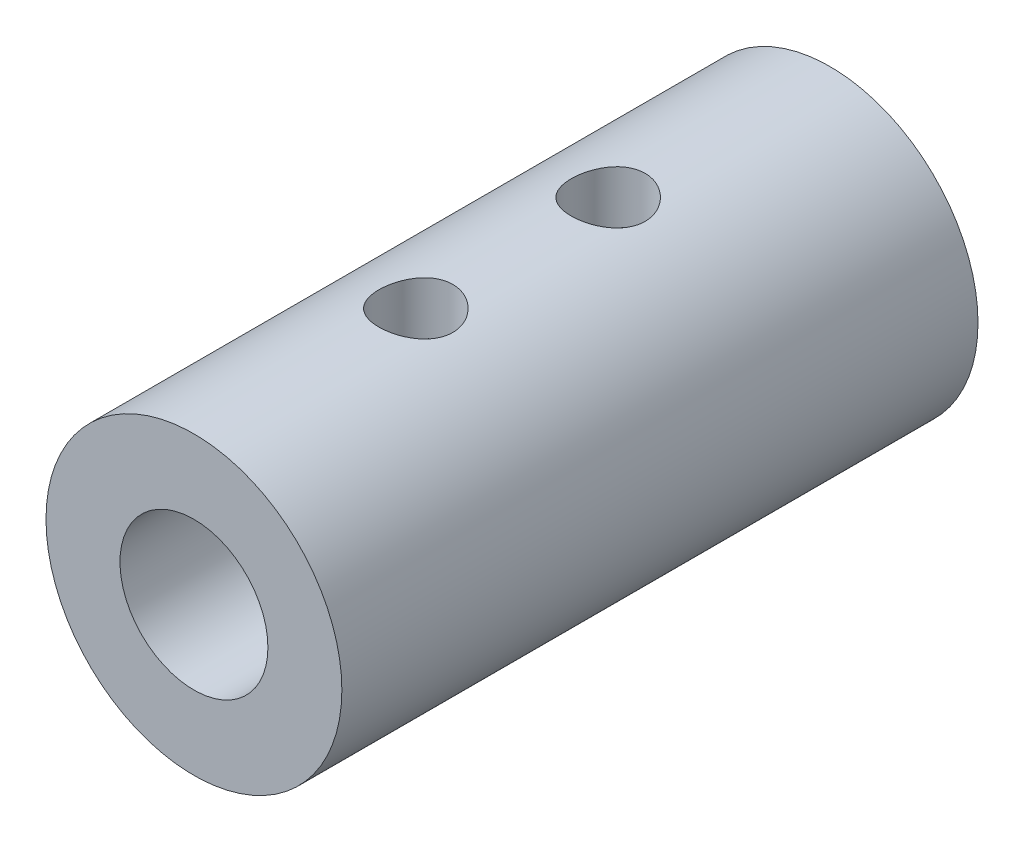
from build123d import *

# Parameters (mm, degrees)
CROQUIS1_R                 = 10
CROQUIS1_R_2               = 5
SALIENTE_EXTRUIR1_DEPTH    = 13
SALIENTE_EXTRUIR2_START    = -30
CROQUIS2_R                 = 10
CROQUIS2_R_2               = 6.48
SALIENTE_EXTRUIR2_DEPTH    = 30
CORTAR_EXTRUIR1_DEPTH      = 39.57274278
CORTAR_EXTRUIR1_DEPTH_BACK = 39.57274278
CROQUIS3_R                 = 2.5


with BuildPart() as part:
    # Croquis1 → Saliente-Extruir1 (new body)
    with BuildSketch(Plane.XY):
        with Locations(Location((-9.736276302, -4.083177315, 0), (0, 0, 180))):
            Circle(CROQUIS1_R)
        with Locations(Location((-9.736276302, -4.083177315, 0), (0, 0, 180))):
            Circle(CROQUIS1_R_2, mode=Mode.SUBTRACT)
    extrude(amount=SALIENTE_EXTRUIR1_DEPTH)

    # Croquis2 → Saliente-Extruir2 (add)
    with BuildSketch(Plane.XY.offset(SALIENTE_EXTRUIR2_START)):
        with Locations(Location((-9.736276302, -4.083177315, 0), (0, 0, 180))):
            Circle(CROQUIS2_R)
        with Locations((-9.736276302, -4.083177315)):
            Circle(CROQUIS2_R_2, mode=Mode.SUBTRACT)
    extrude(amount=SALIENTE_EXTRUIR2_DEPTH)

    # Croquis3 → Cortar-Extruir1 (cut, two sides: drawn at the far end of the back side and taken through both)
    with BuildSketch(Plane(origin=(0, 0, 0), x_dir=(1, 0, 0), z_dir=(0, 1, 0)).offset(-CORTAR_EXTRUIR1_DEPTH_BACK)):
        with Locations(Location((-9.736276302, 15, 0), (0, 0, 270))):
            Circle(CROQUIS3_R)
        with Locations(Location((-9.736276302, 2, 0), (0, 0, 270))):
            Circle(CROQUIS3_R)
    extrude(amount=CORTAR_EXTRUIR1_DEPTH + CORTAR_EXTRUIR1_DEPTH_BACK, mode=Mode.SUBTRACT)


solid = part.part
